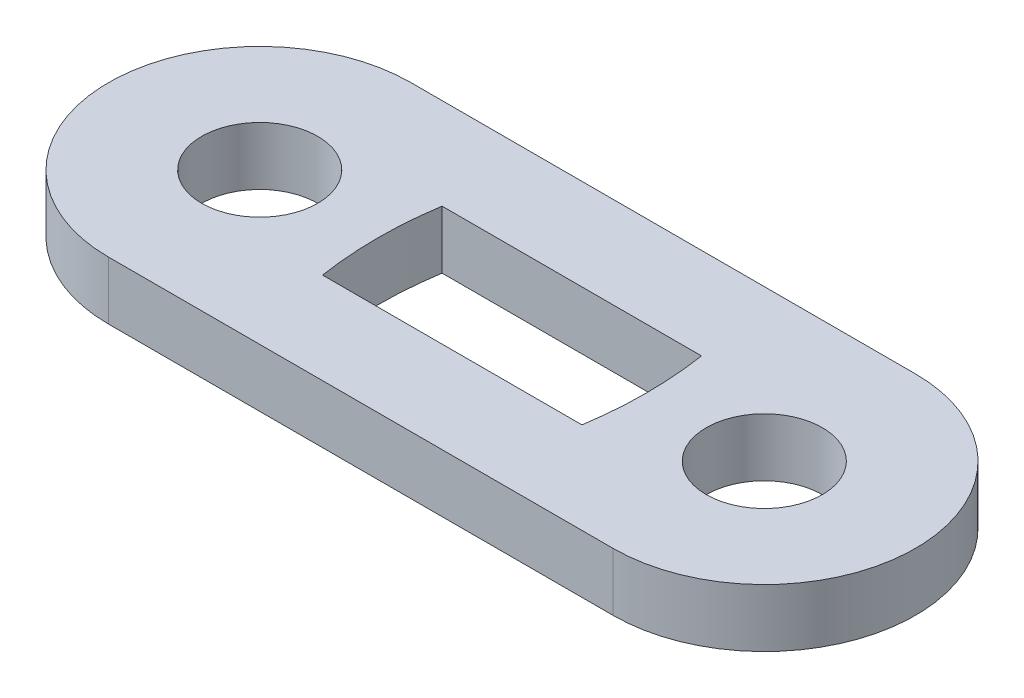
from build123d import *

# Parameters (mm, degrees)
SKETCH1_R           = 1.5875
BOSS_EXTRUDE2_DEPTH = 0.79375


with BuildPart() as part:
    # Sketch1 → Boss-Extrude2 (new, symmetric)
    with BuildSketch(Plane(origin=(0, 0, 0), x_dir=(1, 0, 0), z_dir=(0, 1, 0))):
        with BuildLine():
            Line((6.9, 4.133736316), (-6.9, 4.133736316))
            ThreePointArc((-6.9, 4.133736316), (-11.033736316, 0), (-6.9, -4.133736316))
            Line((-6.9, -4.133736316), (6.9, -4.133736316))
            ThreePointArc((6.9, -4.133736316), (11.033736316, 0), (6.9, 4.133736316))
        make_face()
        with Locations(Location((6.9, 0, 0), (0, 0, 270))):
            Circle(SKETCH1_R, mode=Mode.SUBTRACT)
        with Locations(Location((-6.9, 0, 0), (0, 0, 270))):
            Circle(SKETCH1_R, mode=Mode.SUBTRACT)
        with BuildLine():
            Line((3.54679584, -1.633736316), (-3.54679584, -1.633736316))
            ThreePointArc((-3.54679584, -1.633736316), (-3.673771214, 0), (-3.54679584, 1.633736316))
            Line((-3.54679584, 1.633736316), (3.54679584, 1.633736316))
            ThreePointArc((3.54679584, 1.633736316), (3.673771214, 0), (3.54679584, -1.633736316))
        make_face(mode=Mode.SUBTRACT)
    extrude(amount=BOSS_EXTRUDE2_DEPTH, both=True)


solid = part.part
